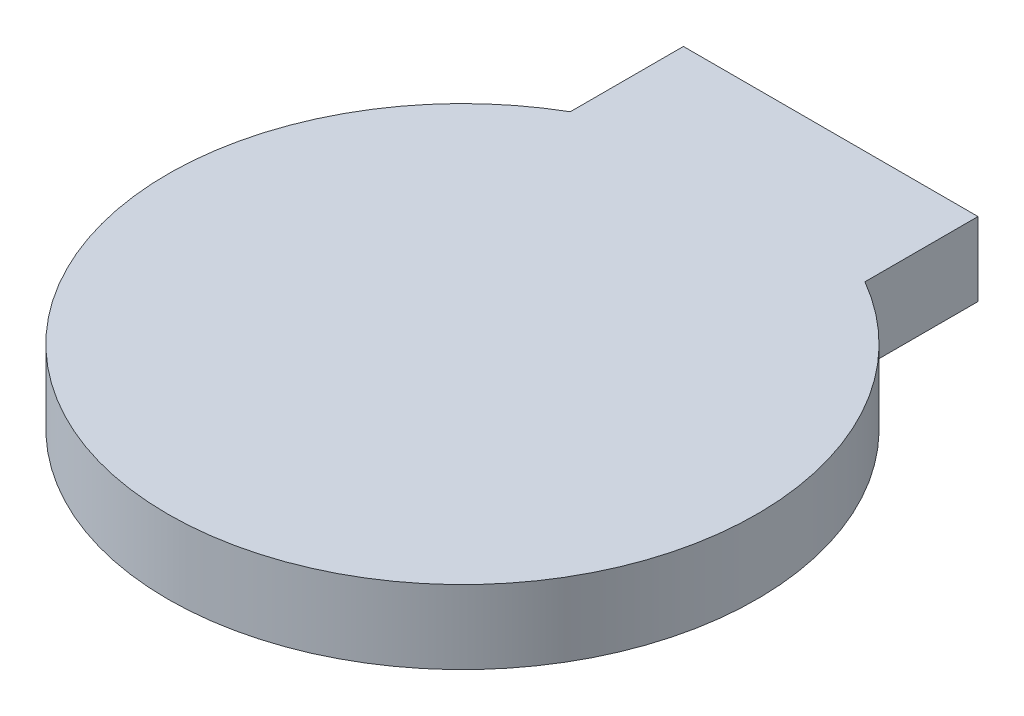
from build123d import *

# Parameters (mm, degrees)
SALIENTE_EXTRUIR1_DEPTH = 3


with BuildPart() as part:
    # Croquis1 → Saliente-Extruir1 (new body)
    with BuildSketch(Plane(origin=(0, 0, 0), x_dir=(1, 0, 0), z_dir=(0, 1, 0))):
        with BuildLine():
            Line((-6, 15), (6, 15))
            Line((6, 15), (6, 10.392304845))
            ThreePointArc((6, 10.392304845), (0, -12), (-6, 10.392304845))
            Line((-6, 10.392304845), (-6, 15))
        make_face()
    extrude(amount=SALIENTE_EXTRUIR1_DEPTH)


solid = part.part
